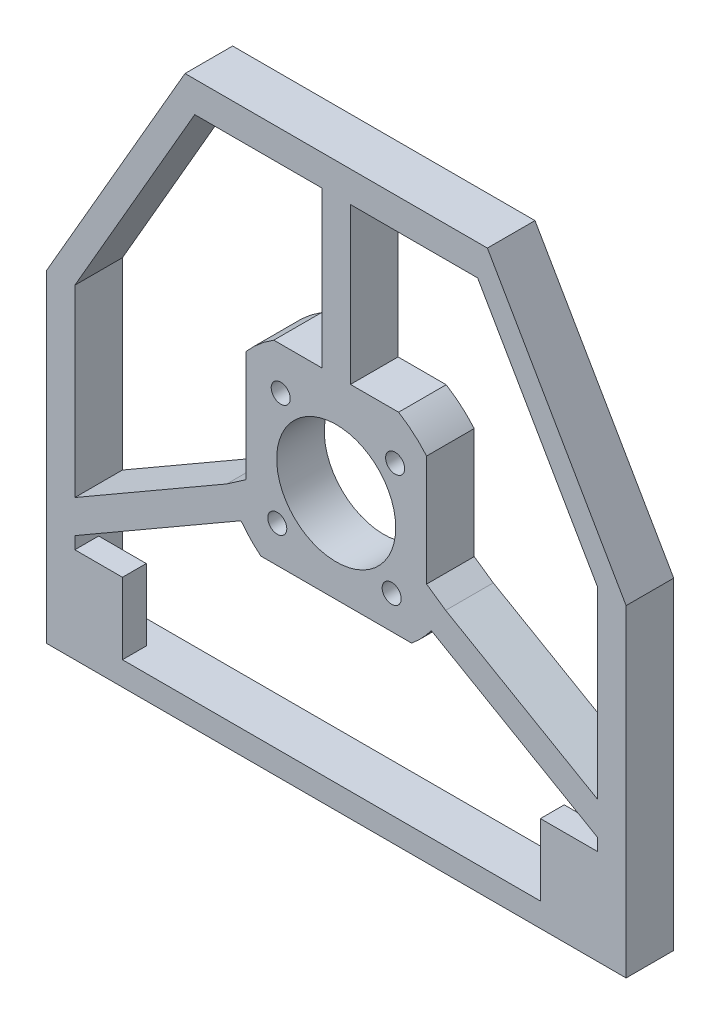
from build123d import *

# Parameters (mm, degrees)
BOSS_EXTRUDE1_DEPTH = 10
SKETCH4_R           = 2
CUT_EXTRUDE1_DEPTH  = 10
CUT_EXTRUDE2_START  = -10
CUT_EXTRUDE2_DEPTH  = 10
SKETCH4_5_R         = 12.5
CUT_EXTRUDE3_DEPTH  = 10
CUT_EXTRUDE4_START  = -10
CUT_EXTRUDE4_DEPTH  = 10
SKETCH5_W           = 5
SKETCH5_H           = 15
BOSS_EXTRUDE2_DEPTH = 10
SKETCH7_W           = 5
SKETCH7_H           = 15
BOSS_EXTRUDE4_DEPTH = 12


with BuildPart() as part:
    # Sketch2 → Boss-Extrude1 (new body)
    with BuildSketch(Plane.XY):
        Polygon((-31.754264805, 60.470053838), (-60.893163975, 10), (-60.893163975, -57.735026919), (60.893163975, -57.735026919), (60.893163975, 10), (31.754264805, 60.470053838), align=None)
        with BuildLine():
            Line((-54.893163975, 10.392304845), (-29.707782181, 54.014665721))
            Line((-29.707782181, 54.014665721), (-3, 54.014665721))
            Line((-3, 54.014665721), (-3, 24.819347292))
            ThreePointArc((-3, 24.819347292), (-21.650635095, 12.5), (-22.99418526, -9.811597435))
            Line((-22.99418526, -9.811597435), (-54.893163975, -28.228481382))
            Line((-54.893163975, -28.228481382), (-54.893163975, 10.392304845))
        make_face(mode=Mode.SUBTRACT)
        with BuildLine():
            Line((-54.893163975, -35.156684613), (-19.99418526, -15.007749857))
            ThreePointArc((-19.99418526, -15.007749857), (0, -25), (19.99418526, -15.007749857))
            Line((19.99418526, -15.007749857), (54.893163975, -35.156684613))
            Line((54.893163975, -35.156684613), (54.893163975, -52.735026919))
            Line((54.893163975, -52.735026919), (-54.893163975, -52.735026919))
            Line((-54.893163975, -52.735026919), (-54.893163975, -35.156684613))
        make_face(mode=Mode.SUBTRACT)
        with BuildLine():
            Line((54.893163975, -28.228481382), (22.99418526, -9.811597435))
            ThreePointArc((22.99418526, -9.811597435), (24.493413722, -5.007263149), (25, 0))
            Line((25, 0), (24.879996994, 2.446579159))
            ThreePointArc((24.879996994, 2.446579159), (17.873408924, 17.479738368), (3, 24.819347292))
            Line((3, 24.819347292), (3, 54.014665721))
            Line((3, 54.014665721), (29.707782181, 54.014665721))
            Line((29.707782181, 54.014665721), (54.893163975, 10.392304845))
            Line((54.893163975, 10.392304845), (54.893163975, -28.228481382))
        make_face(mode=Mode.SUBTRACT)
    extrude(amount=BOSS_EXTRUDE1_DEPTH)

    # Sketch4 → Cut-Extrude1 (cut)
    with BuildSketch(Plane.XY.offset(10)):
        with Locations((-12.377645895, -11.653063206)):
            Circle(SKETCH4_R)
        with Locations((-11.653063206, 12.377645895)):
            Circle(SKETCH4_R)
        with Locations((11.653063206, -12.377645895)):
            Circle(SKETCH4_R)
        with Locations((12.377645895, 11.653063206)):
            Circle(SKETCH4_R)
    extrude(amount=-CUT_EXTRUDE1_DEPTH, mode=Mode.SUBTRACT)

    # Sketch4<4> → Cut-Extrude2 (cut)
    with BuildSketch(Plane.XY.offset(10).offset(CUT_EXTRUDE2_START)):
        with BuildLine():
            Line((-18.989077055, -7.037341973), (-18.989077055, 16.260841079))
            ThreePointArc((-18.989077055, 16.260841079), (-24.443440144, 5.245782491), (-23.989077055, -7.037341973))
            Line((-23.989077055, -7.037341973), (-18.989077055, -7.037341973))
        make_face()
        with BuildLine():
            Line((-13.106268079, 21.289099019), (-3, 21.289099019))
            Line((-3, 21.289099019), (-3, 24.819347292))
            ThreePointArc((-3, 24.819347292), (-8.244309011, 23.601512005), (-13.106268079, 21.289099019))
        make_face()
        with BuildLine():
            Line((3, 24.819347292), (3, 21.289099019))
            Line((3, 21.289099019), (13.106268079, 21.289099019))
            ThreePointArc((13.106268079, 21.289099019), (8.244309011, 23.601512005), (3, 24.819347292))
        make_face()
        with BuildLine():
            ThreePointArc((24.879996994, 2.446579159), (22.996355637, 9.806509441), (18.989077055, 16.260841079))
            Line((18.989077055, 16.260841079), (18.989077055, -7.037341973))
            Line((18.989077055, -7.037341973), (23.989077055, -7.037341973))
            ThreePointArc((23.989077055, -7.037341973), (24.745978728, -3.554790685), (25, 0))
            Line((25, 0), (24.879996994, 2.446579159))
        make_face()
        with BuildLine():
            Line((15.832343221, -19.347788198), (-15.832343221, -19.347788198))
            ThreePointArc((-15.832343221, -19.347788198), (0, -25), (15.832343221, -19.347788198))
        make_face()
    extrude(amount=CUT_EXTRUDE2_DEPTH, mode=Mode.SUBTRACT)

    # Sketch4<5> → Cut-Extrude3 (cut)
    with BuildSketch(Plane.XY.offset(10)):
        Circle(SKETCH4_5_R)
    extrude(amount=-CUT_EXTRUDE3_DEPTH, mode=Mode.SUBTRACT)

    # Sketch4<6> → Cut-Extrude4 (cut)
    with BuildSketch(Plane.XY.offset(10).offset(CUT_EXTRUDE4_START)):
        with BuildLine():
            Line((-22.99418526, -9.811597435), (-18.989077055, -7.037341973))
            Line((-18.989077055, -7.037341973), (-23.989077055, -7.037341973))
            ThreePointArc((-23.989077055, -7.037341973), (-23.532548901, -8.439143452), (-22.99418526, -9.811597435))
        make_face()
        with BuildLine():
            Line((23.989077055, -7.037341973), (18.989077055, -7.037341973))
            Line((18.989077055, -7.037341973), (22.99418526, -9.811597435))
            ThreePointArc((22.99418526, -9.811597435), (23.532548901, -8.439143452), (23.989077055, -7.037341973))
        make_face()
    extrude(amount=CUT_EXTRUDE4_DEPTH, mode=Mode.SUBTRACT)

    # Sketch5 → Boss-Extrude2 (add)
    with BuildSketch(Plane(origin=(-54.893163975, 0, 0), x_dir=(0, 0, -1), z_dir=(1, 0, 0))):
        with Locations((-7.5, -45.235026919)):
            Rectangle(SKETCH5_W, SKETCH5_H)
    extrude(amount=BOSS_EXTRUDE2_DEPTH)

    # Sketch7 → Boss-Extrude4 (add)
    with BuildSketch(Plane.ZY.offset(-54.893163975)):
        with Locations((7.5, -45.235026919)):
            Rectangle(SKETCH7_W, SKETCH7_H)
    extrude(amount=BOSS_EXTRUDE4_DEPTH)


solid = part.part
